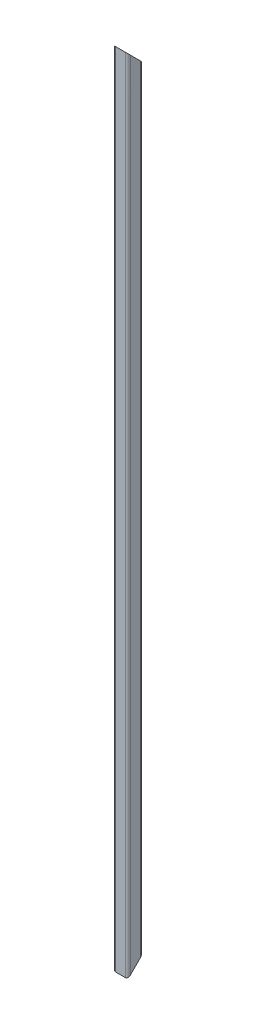
from build123d import *

# Parameters (mm, degrees)
EXTRUDE_1_DEPTH     = 3240
CUT_EXTRUDE_1_DEPTH = 3241.694370039


with BuildPart() as part:
    # Эскиз1 → Бобышка-Вытянуть1 (new body)
    with BuildSketch(Plane(origin=(0, 0, 0), x_dir=(1, 0, 0), z_dir=(0, 1, 0))):
        with BuildLine():
            Line((-20, 30), (20, 30))
            ThreePointArc((20, 30), (27.071067812, 27.071067812), (30, 20))
            Line((30, 20), (30, -20))
            ThreePointArc((30, -20), (27.071067812, -27.071067812), (20, -30))
            Line((20, -30), (-20, -30))
            ThreePointArc((-20, -30), (-27.071067812, -27.071067812), (-30, -20))
            Line((-30, -20), (-30, 20))
            ThreePointArc((-30, 20), (-27.071067812, 27.071067812), (-20, 30))
        make_face()
        with BuildLine():
            Line((-16, 26), (16, 26))
            ThreePointArc((16, 26), (23.071067812, 23.071067812), (26, 16))
            Line((26, 16), (26, -16))
            ThreePointArc((26, -16), (23.071067812, -23.071067812), (16, -26))
            Line((16, -26), (-16, -26))
            ThreePointArc((-16, -26), (-23.071067812, -23.071067812), (-26, -16))
            Line((-26, -16), (-26, 16))
            ThreePointArc((-26, 16), (-23.071067812, 23.071067812), (-16, 26))
        make_face(mode=Mode.SUBTRACT)
    extrude(amount=EXTRUDE_1_DEPTH)

    # Эскиз2 → Вырез-Вытянуть1 (cut, through all)
    with BuildSketch(Plane(origin=(30, 0, 0), x_dir=(0, 0, -1), z_dir=(1, 0, 0))):
        Polygon((-30, 0), (30, 0), (30, 60), align=None)
        Polygon((-30, 3240), (30, 3240), (30, 3180), align=None)
    extrude(amount=-CUT_EXTRUDE_1_DEPTH, mode=Mode.SUBTRACT)


solid = part.part
